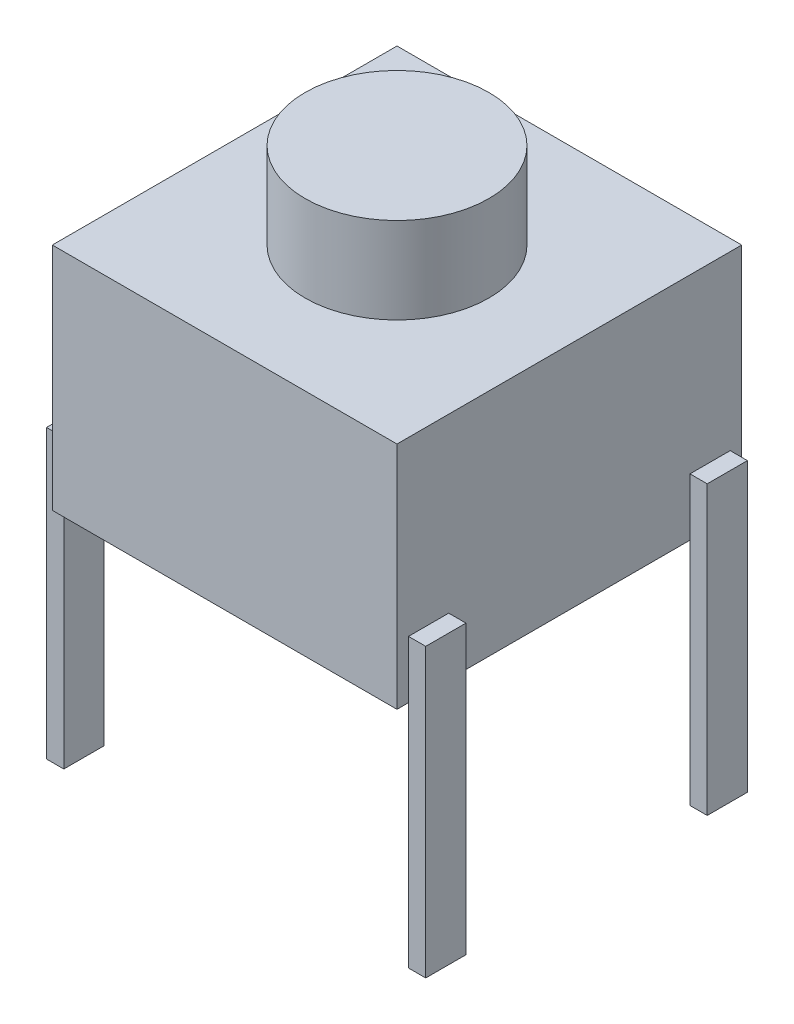
from build123d import *

# Parameters (mm, degrees)
SKETCH1_W                 = 6
SKETCH1_H                 = 6
BOSS_EXTRUDE1_DEPTH       = 4
SKETCH2_R                 = 1.6
BOSS_EXTRUDE2_DEPTH       = 1.5
SKETCH3_W                 = 0.7
SKETCH3_H                 = 5
BOSS_EXTRUDE3_DEPTH       = 0.3
LPATTERN2_COUNT           = 2
LPATTERN2_PITCH           = 6.3
LPATTERN3_COUNT           = 2
LPATTERN3_PITCH           = 4.9
LPATTERN3_COPY_1_SKETCH_W = 0.7
LPATTERN3_COPY_1_SKETCH_H = 5
LPATTERN3_COPY_1_DEPTH    = 0.3


with BuildPart() as part:
    # Sketch1 → Boss-Extrude1 (new body)
    with BuildSketch(Plane(origin=(0, 0, 0), x_dir=(1, 0, 0), z_dir=(0, 1, 0))):
        with Locations((3, 3)):
            Rectangle(SKETCH1_W, SKETCH1_H)
    extrude(amount=BOSS_EXTRUDE1_DEPTH)

    # Sketch2 → Boss-Extrude2 (add)
    with BuildSketch(Plane(origin=(0, 4, 0), x_dir=(1, 0, 0), z_dir=(0, 1, 0))):
        with Locations(Location((3, 3, 0), (0, 0, 270))):
            Circle(SKETCH2_R)
    extrude(amount=BOSS_EXTRUDE2_DEPTH)

    # Sketch3 → Boss-Extrude3 (add)
    with BuildSketch(Plane.ZY):
        with Locations((-0.55, -1.5)):
            Rectangle(SKETCH3_W, SKETCH3_H)
    boss_extrude3 = extrude(amount=BOSS_EXTRUDE3_DEPTH)

    # LPattern2: Boss-Extrude3 ×2
    with Locations(*[(i * LPATTERN2_PITCH, 0, 0) for i in range(1, LPATTERN2_COUNT)]):
        add(boss_extrude3)

    # LPattern3: Boss-Extrude3 ×2
    with Locations(*[(0, 0, -i * LPATTERN3_PITCH) for i in range(1, LPATTERN3_COUNT)]):
        add(boss_extrude3)

    # LPattern3 copy 1 sketch → LPattern3 copy 1 (add)
    with BuildSketch(Plane(origin=(6.3, 0, -4.9), x_dir=(0, 0, 1), z_dir=(-1, 0, 0))):
        with Locations((-0.55, -1.5)):
            Rectangle(LPATTERN3_COPY_1_SKETCH_W, LPATTERN3_COPY_1_SKETCH_H)
    extrude(amount=LPATTERN3_COPY_1_DEPTH)


solid = part.part
